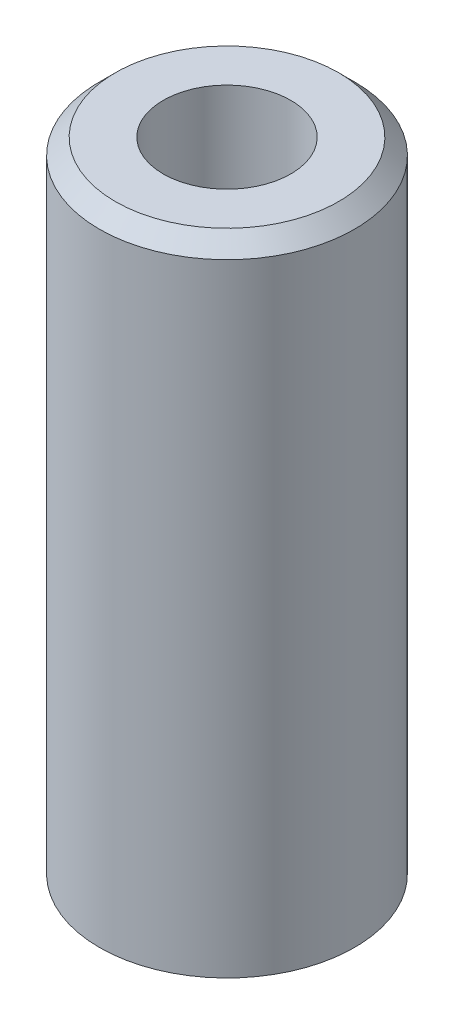
from build123d import *

# Parameters (mm, degrees)
SKETCH1_R           = 4
SKETCH1_R_2         = 2
BOSS_EXTRUDE1_DEPTH = 20
CHAMFER1_SIZE       = 0.5


with BuildPart() as part:
    # Sketch1 → Boss-Extrude1 (new body)
    with BuildSketch(Plane(origin=(0, 0, 0), x_dir=(1, 0, 0), z_dir=(0, 1, 0))):
        with Locations(Location((0, 0, 0), (0, 0, 270))):
            Circle(SKETCH1_R)
        with Locations(Location((0, 0, 0), (0, 0, 270))):
            Circle(SKETCH1_R_2, mode=Mode.SUBTRACT)
    extrude(amount=BOSS_EXTRUDE1_DEPTH)

    # Chamfer1
    chamfer1_edges = [part.edges().sort_by_distance(p)[0] for p in [
        (0, 20, -4),
    ]]
    chamfer(chamfer1_edges, length=CHAMFER1_SIZE)


solid = part.part
